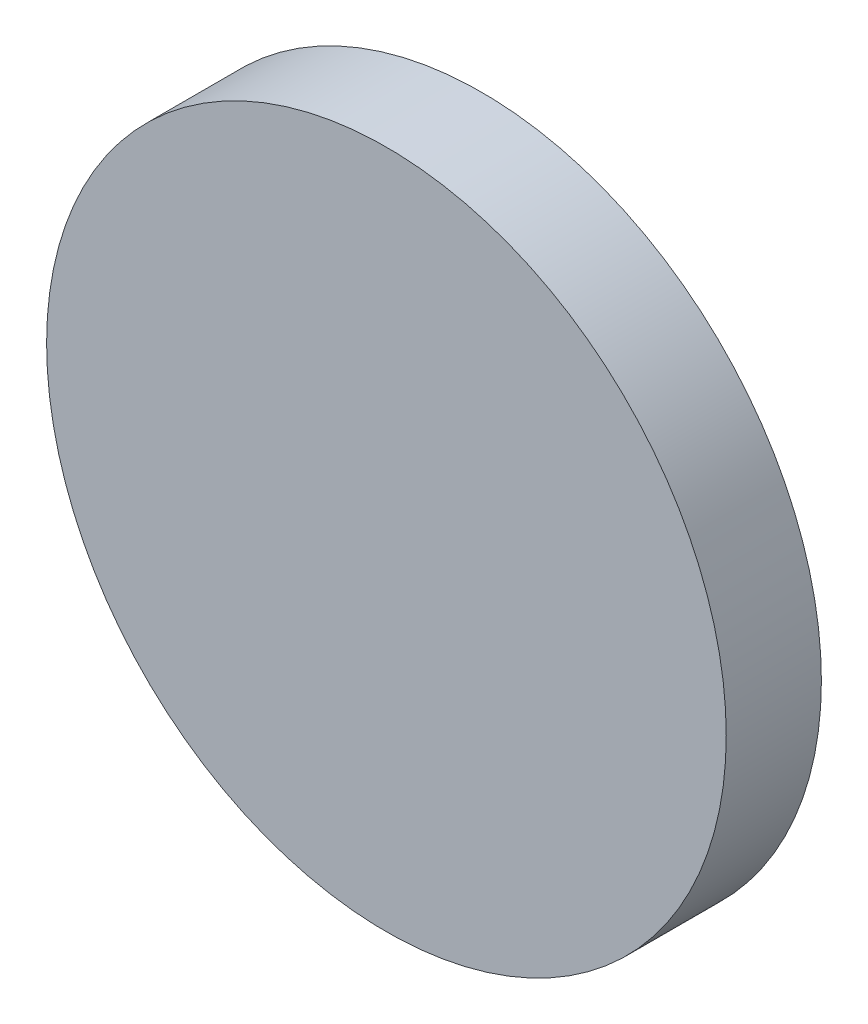
from build123d import *

# Parameters (mm, degrees)
SKETCH1_R           = 25
BOSS_EXTRUDE1_DEPTH = 7
SKETCH2_R           = 3.5
CUT_EXTRUDE1_DEPTH  = 5


with BuildPart() as part:
    # Sketch1 → Boss-Extrude1 (new body)
    with BuildSketch(Plane.XY):
        Circle(SKETCH1_R)
    extrude(amount=BOSS_EXTRUDE1_DEPTH)

    # Sketch2 → Cut-Extrude1 (cut)
    with BuildSketch(Plane(origin=(0, 0, 0), x_dir=(-1, 0, 0), z_dir=(0, 0, -1))):
        Circle(SKETCH2_R)
    extrude(amount=-CUT_EXTRUDE1_DEPTH, mode=Mode.SUBTRACT)


solid = part.part
